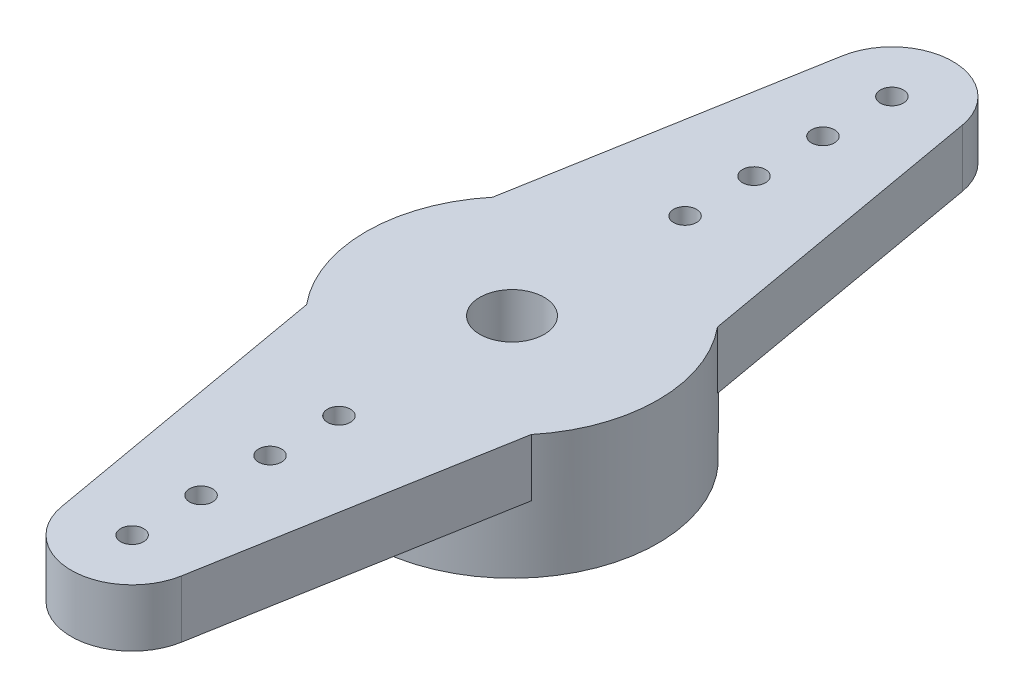
from build123d import *

# Parameters (mm, degrees)
SKETCH1_R               = 6.35
BOSS_EXTRUDE1_DEPTH     = 5.4
HORN_START              = -2.5
HORN_DEPTH              = 2.5
SKETCH4_R               = 1.4
CUT_EXTRUDE1_DEPTH      = 21.913031822
SKETCH5_R               = 0.5
CUT_EXTRUDE2_DEPTH      = 21.913031822
LPATTERN1_COUNT         = 4
LPATTERN1_PITCH         = 3
MIRROR1_COPY_1_SKETCH_R = 0.5
MIRROR1_COPY_1_DEPTH    = 21.913031822
MIRROR1_COPY_2_SKETCH_R = 0.5
MIRROR1_COPY_2_DEPTH    = 21.913031822
MIRROR1_COPY_3_SKETCH_R = 0.5
MIRROR1_COPY_3_DEPTH    = 21.913031822


with BuildPart() as part:
    # Sketch1 → Boss-Extrude1 (new body)
    with BuildSketch(Plane(origin=(0, 0, 0), x_dir=(1, 0, 0), z_dir=(0, 1, 0))):
        with Locations(Location((0, 0, 0), (0, 0, 90))):
            Circle(SKETCH1_R)
    extrude(amount=BOSS_EXTRUDE1_DEPTH)

    # Sketch2 → horn (add)
    with BuildSketch(Plane(origin=(0, 5.4, 0), x_dir=(1, 0, 0), z_dir=(0, 1, 0)).offset(HORN_START)):
        with BuildLine():
            Line((-2.609740545, 16.990167671), (-4.891612682, 4.049027706))
            ThreePointArc((-4.891612682, 4.049027706), (0, 6.35), (4.891612682, 4.049027706))
            Line((4.891612682, 4.049027706), (2.609740545, 16.990167671))
            ThreePointArc((2.609740545, 16.990167671), (0, 19.18), (-2.609740545, 16.990167671))
        make_face()
    horn = extrude(amount=HORN_DEPTH)

    # Sketch4 → Cut-Extrude1 (cut, through all)
    with BuildSketch(Plane(origin=(0, 5.4, 0), x_dir=(-1, 0, 0), z_dir=(0, -1, 0))):
        with Locations(Location((0, 0, 0), (0, 0, 270))):
            Circle(SKETCH4_R)
    extrude(amount=CUT_EXTRUDE1_DEPTH, mode=Mode.SUBTRACT)

    # Sketch5 → Cut-Extrude2 (cut, through all)
    with BuildSketch(Plane(origin=(0, 0, 0), x_dir=(-1, 0, 0), z_dir=(0, -1, 0))):
        with Locations(Location((0, 16.53, 0), (0, 0, 90))):
            Circle(SKETCH5_R)
    cut_extrude2 = extrude(amount=-CUT_EXTRUDE2_DEPTH, mode=Mode.SUBTRACT)

    # LPattern1: Cut-Extrude2 ×4
    with Locations(*[(0, 0, i * LPATTERN1_PITCH) for i in range(1, LPATTERN1_COUNT)]):
        add(cut_extrude2, mode=Mode.SUBTRACT)

    # Mirror1: horn, Cut-Extrude2 across plane
    add(horn.mirror(Plane.XY))
    add(cut_extrude2.mirror(Plane.XY), mode=Mode.SUBTRACT)

    # Mirror1 copy 1 sketch → Mirror1 copy 1 (cut, through all)
    with BuildSketch(Plane(origin=(0, 0, -3), x_dir=(-1, 0, 0), z_dir=(0, -1, 0))):
        with Locations((0, -16.53)):
            Circle(MIRROR1_COPY_1_SKETCH_R)
    extrude(amount=-MIRROR1_COPY_1_DEPTH, mode=Mode.SUBTRACT)

    # Mirror1 copy 2 sketch → Mirror1 copy 2 (cut, through all)
    with BuildSketch(Plane(origin=(0, 0, -6), x_dir=(-1, 0, 0), z_dir=(0, -1, 0))):
        with Locations((0, -16.53)):
            Circle(MIRROR1_COPY_2_SKETCH_R)
    extrude(amount=-MIRROR1_COPY_2_DEPTH, mode=Mode.SUBTRACT)

    # Mirror1 copy 3 sketch → Mirror1 copy 3 (cut, through all)
    with BuildSketch(Plane(origin=(0, 0, -9), x_dir=(-1, 0, 0), z_dir=(0, -1, 0))):
        with Locations((0, -16.53)):
            Circle(MIRROR1_COPY_3_SKETCH_R)
    extrude(amount=-MIRROR1_COPY_3_DEPTH, mode=Mode.SUBTRACT)


solid = part.part
